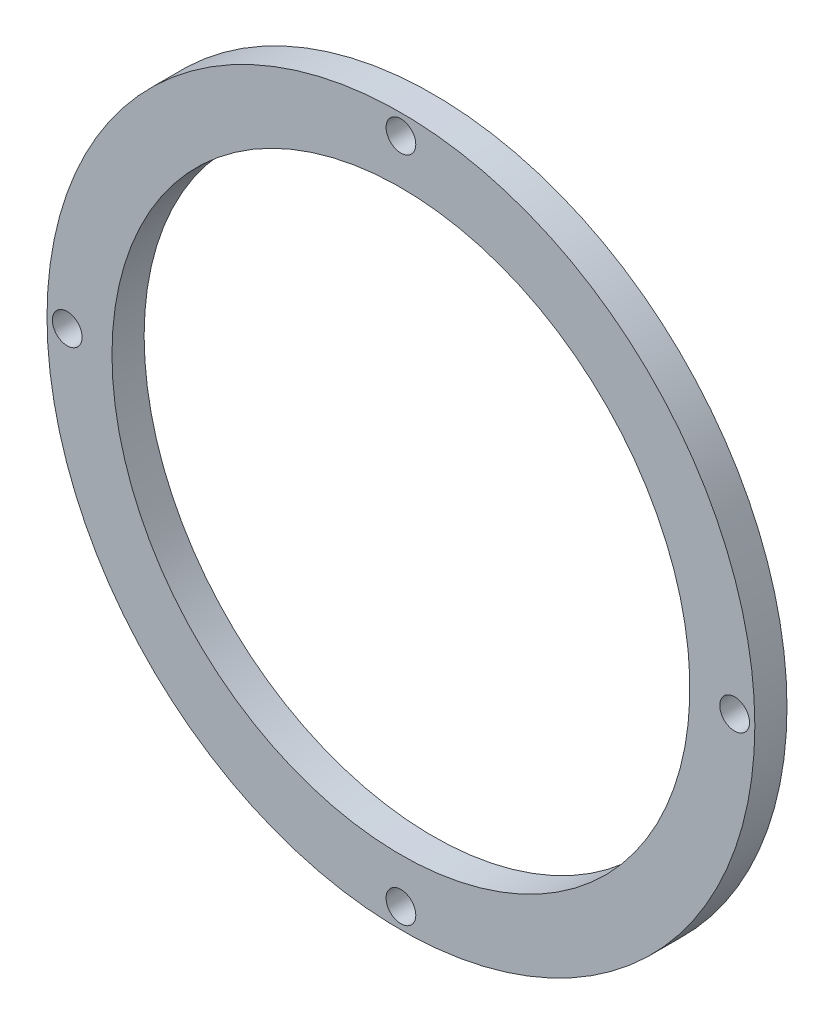
from build123d import *

# Parameters (mm, degrees)
SKETCH1_R           = 35
SKETCH1_R_2         = 28.575
BOSS_EXTRUDE1_DEPTH = 3.18
SKETCH2_R           = 1.47
CUT_EXTRUDE1_DEPTH  = 3.18
CIRPATTERN1_COUNT   = 4


with BuildPart() as part:
    # Sketch1 → Boss-Extrude1 (new body)
    with BuildSketch(Plane.XY):
        with Locations(Location((0, 0, 0), (0, 0, 180))):
            Circle(SKETCH1_R)
        with Locations(Location((0, 0, 0), (0, 0, 180))):
            Circle(SKETCH1_R_2, mode=Mode.SUBTRACT)
    extrude(amount=BOSS_EXTRUDE1_DEPTH)

    # Sketch2 → Cut-Extrude1 (cut)
    with BuildSketch(Plane.XY.offset(3.18)):
        with Locations((0, 33)):
            Circle(SKETCH2_R)
    cut_extrude1 = extrude(amount=-CUT_EXTRUDE1_DEPTH, mode=Mode.SUBTRACT)

    # CirPattern1: Cut-Extrude1 ×4 about axis
    cirpattern1_axis = Axis((0, 0, 0), (0, 0, 1))
    for i in range(1, CIRPATTERN1_COUNT):
        add(cut_extrude1.rotate(cirpattern1_axis, i * 360 / CIRPATTERN1_COUNT), mode=Mode.SUBTRACT)


solid = part.part
